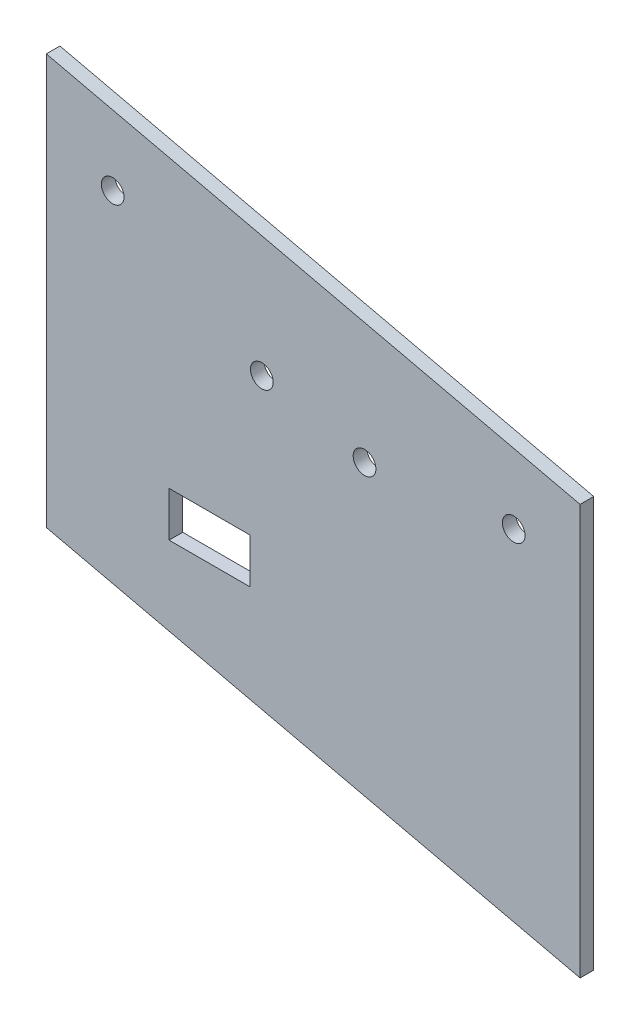
from build123d import *

# Parameters (mm, degrees)
RESSALTO_EXTRUS_O1_DEPTH                = 3
BROCA_DE_ROSQUEAR_PARA_TARRAXA_DE_M61_D = 5
ESBO_O4_W                               = 17.804449836
ESBO_O4_H                               = 9.873376728
CORTE_EXTRUS_O1_DEPTH                   = 149.227737241


with BuildPart() as part:
    # Esboço1 → Ressalto-extrusão1 (new body)
    with BuildSketch(Plane.XY):
        Polygon((0, 0), (117.509029813, -27.129097154), (117.509029813, 63.170902846), (0, 90.3), align=None)
    extrude(amount=RESSALTO_EXTRUS_O1_DEPTH)

    # Broca de rosquear para tarraxa de M61 (through all)
    with Locations(Plane.XY.offset(3)):
        with Locations((14.615550972, 71.531172568), (102.893478841, 51.150607044), (70.057207658, 47.44211239), (47.451822155, 52.660976851)):
            Hole(BROCA_DE_ROSQUEAR_PARA_TARRAXA_DE_M61_D / 2)

    # Esboço4 → Corte-extrusão1 (cut, through all)
    with BuildSketch(Plane.XY.offset(3)):
        with Locations((35.932447389, 16.047022475)):
            Rectangle(ESBO_O4_W, ESBO_O4_H)
    extrude(amount=-CORTE_EXTRUS_O1_DEPTH, mode=Mode.SUBTRACT)


solid = part.part
